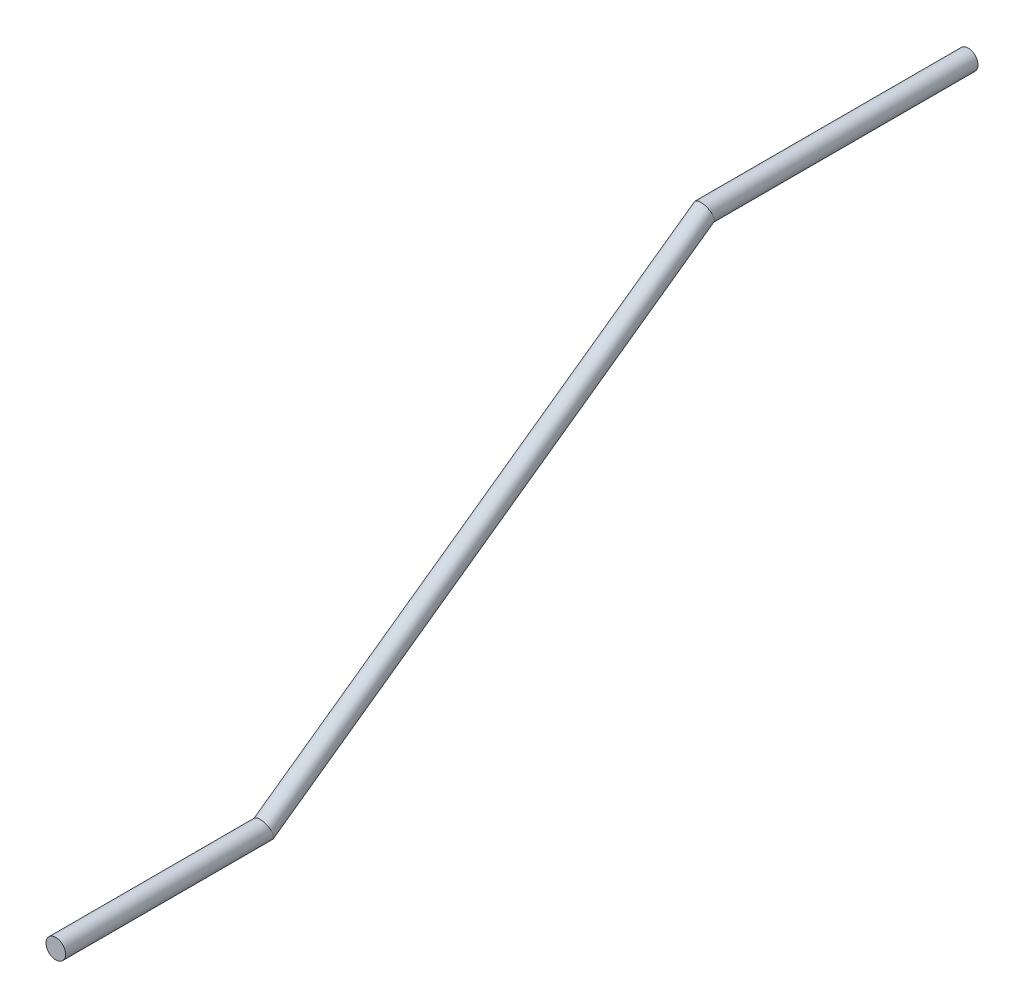
from build123d import *

# Parameters (mm, degrees)
ROUND_TPU_CORD_1_2_MM_PROFILE_R = 0.6


with BuildPart() as part:
    # Round TPU cord - 1.2 mm: sweep along a curve in space
    with BuildLine() as round_tpu_cord_1_2_mm_path:
        Line((15, 25.980762114, -16.2), (15, 25.980762114, 0))
        Line((15, 25.980762114, 0), (13.907739889, 5.619143278, 25.959933688))
        Line((13.907739889, 5.619143278, 25.959933688), (13.907739889, 5.619143278, 38.709933688))
    # Round TPU cord - 1.2 mm profile (on start of the path) → Round TPU cord - 1.2 mm (sweep)
    with BuildSketch(Plane(origin=(15, 25.980762114, -16.2), x_dir=(1, 0, 0), z_dir=(0, 0, 1))):
        Circle(ROUND_TPU_CORD_1_2_MM_PROFILE_R)
    sweep(path=round_tpu_cord_1_2_mm_path.line, transition=Transition.RIGHT)


solid = part.part
